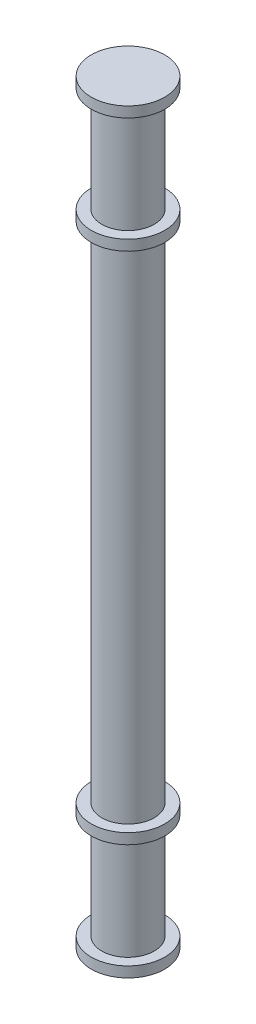
from build123d import *

# Parameters (mm, degrees)
SKETCH_1_R        = 5
EXTRUDE_1_DEPTH   = 144
EXTRUDE_START     = -2
SKETCH_4_R        = 7
SKETCH_4_R_2      = 5
EXTRUDE_1_2_DEPTH = 2
SKETCH_5_R        = 7
SKETCH_5_R_2      = 5
EXTRUDE_2_DEPTH   = 2
EXTRUDE_START_2   = -22
SKETCH_6_R        = 7
SKETCH_6_R_2      = 5
EXTRUDE_3_DEPTH   = 2
SKETCH_7_R        = 7
SKETCH_7_R_2      = 5
EXTRUDE_4_DEPTH   = 2


with BuildPart() as part:
    # 草图1 → Extrude 1 (new body)
    with BuildSketch(Plane(origin=(0, 0, 0), x_dir=(1, 0, 0), z_dir=(0, 1, 0))):
        with Locations(Location((0, -1.156601006, 0), (0, 0, 270))):
            Circle(SKETCH_1_R)
    extrude(amount=EXTRUDE_1_DEPTH)

    # 草图4 → Extrude 1 2 (add)
    with BuildSketch(Plane(origin=(0, 144, 0), x_dir=(1, 0, 0), z_dir=(0, 1, 0)).offset(EXTRUDE_START)):
        with Locations((0, -1.156601006)):
            Circle(SKETCH_4_R)
        with Locations((0, -1.156601006)):
            Circle(SKETCH_4_R_2, mode=Mode.SUBTRACT)
    extrude(amount=EXTRUDE_1_2_DEPTH)

    # 草图5 → 拉伸-薄壁2 (add)
    with BuildSketch(Plane.XZ):
        with Locations((0, 1.156601006)):
            Circle(SKETCH_5_R)
        with Locations((0, 1.156601006)):
            Circle(SKETCH_5_R_2, mode=Mode.SUBTRACT)
    extrude(amount=-EXTRUDE_2_DEPTH)

    # 草图7 → 拉伸-薄壁4 (add)
    with BuildSketch(Plane(origin=(0, 0, 0), x_dir=(-1, 0, 0), z_dir=(0, -1, 0)).offset(EXTRUDE_START_2)):
        with Locations((0, -1.156601006)):
            Circle(SKETCH_7_R)
        with Locations((0, -1.156601006)):
            Circle(SKETCH_7_R_2, mode=Mode.SUBTRACT)
    extrude(amount=-EXTRUDE_4_DEPTH)


with BuildPart() as body_2:
    # 草图6 → 拉伸-薄壁3 (new body)
    with BuildSketch(Plane(origin=(0, 144, 0), x_dir=(1, 0, 0), z_dir=(0, 1, 0)).offset(EXTRUDE_START_2)):
        with Locations((0, -1.156601006)):
            Circle(SKETCH_6_R)
        with Locations((0, -1.156601006)):
            Circle(SKETCH_6_R_2, mode=Mode.SUBTRACT)
    extrude(amount=-EXTRUDE_3_DEPTH)


solid = Compound([part.part, body_2.part])
